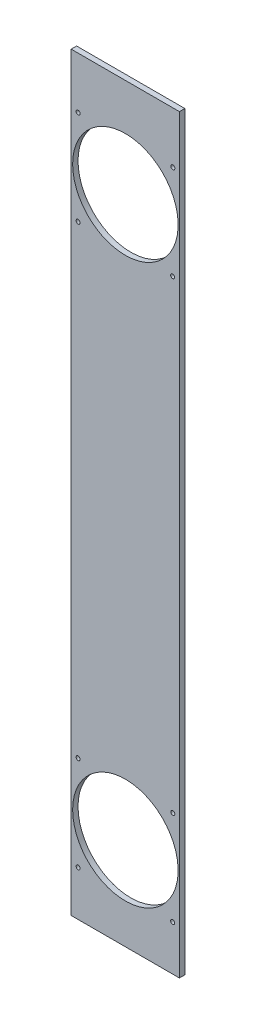
from build123d import *

# Parameters (mm, degrees)
ESQUISSE1_W                   = 120
ESQUISSE1_H                   = 832
BOSS_EXTRU_1_DEPTH            = 6
SKETCH1_R                     = 58.5
CUT_EXTRUDE1_DEPTH            = 10
LPATTERN1_COUNT               = 2
LPATTERN1_PITCH               = 620
M4_CLEARANCE_HOLE1_AT_2_COUNT = 2
M4_CLEARANCE_HOLE1_AT_2_PITCH = 104.8
M4_CLEARANCE_HOLE1_AT_3_COUNT = 2
M4_CLEARANCE_HOLE1_AT_3_PITCH = 148.351070101
M4_CLEARANCE_HOLE1_AT_4_COUNT = 2
M4_CLEARANCE_HOLE1_AT_4_PITCH = 104.8
LPATTERN2_COUNT               = 2
LPATTERN2_PITCH               = 620


with BuildPart() as part:
    # Esquisse1 → Boss.-Extru.1 (new body)
    with BuildSketch(Plane.XY):
        Rectangle(ESQUISSE1_W, ESQUISSE1_H)
    extrude(amount=BOSS_EXTRU_1_DEPTH)

    # Sketch1 → Cut-Extrude1 (cut)
    with BuildSketch(Plane(origin=(0, 0, 0), x_dir=(-1, 0, 0), z_dir=(0, 0, -1))):
        with Locations((-0.1, 306.5)):
            Circle(SKETCH1_R)
    cut_extrude1 = extrude(amount=-CUT_EXTRUDE1_DEPTH, mode=Mode.SUBTRACT)

    # LPattern1: Cut-Extrude1 ×2
    with Locations(*[(0, -i * LPATTERN1_PITCH, 0) for i in range(1, LPATTERN1_COUNT)]):
        add(cut_extrude1, mode=Mode.SUBTRACT)

    # Sketch2 → M4 Clearance Hole1 (revolve, cut)
    with BuildSketch(Plane(origin=(-52.3, 254.1, 0), x_dir=(0, 1, 0), z_dir=(1, 0, 0))):
        Polygon((0, 0), (0, 7.351936393), (2.25, 6), (2.25, 0), align=None)
    m4_clearance_hole1 = revolve(axis=Axis((-52.3, 254.1, -6.35), (0, 0, 1)), mode=Mode.SUBTRACT)

    # M4 Clearance Hole1 at 2: M4 Clearance Hole1 ×2
    with Locations(*[(0, i * M4_CLEARANCE_HOLE1_AT_2_PITCH, 0) for i in range(1, M4_CLEARANCE_HOLE1_AT_2_COUNT)]):
        add(m4_clearance_hole1, mode=Mode.SUBTRACT)

    # M4 Clearance Hole1 at 3: M4 Clearance Hole1 ×2
    with Locations(*[Vector(0.7077805365932406, 0.7064323831901992, 0) * (i * M4_CLEARANCE_HOLE1_AT_3_PITCH) for i in range(1, M4_CLEARANCE_HOLE1_AT_3_COUNT)]):
        add(m4_clearance_hole1, mode=Mode.SUBTRACT)

    # M4 Clearance Hole1 at 4: M4 Clearance Hole1 ×2
    with Locations(*[(i * M4_CLEARANCE_HOLE1_AT_4_PITCH, 0, 0) for i in range(1, M4_CLEARANCE_HOLE1_AT_4_COUNT)]):
        add(m4_clearance_hole1, mode=Mode.SUBTRACT)

    # LPattern2: M4 Clearance Hole1 ×2
    with Locations(*[(0, -i * LPATTERN2_PITCH, 0) for i in range(1, LPATTERN2_COUNT)]):
        add(m4_clearance_hole1, mode=Mode.SUBTRACT)

    # LPattern2 copy 1 sketch → LPattern2 copy 1 (revolve, cut)
    with BuildSketch(Plane(origin=(-52.3, -261.1, 0), x_dir=(0, 1, 0), z_dir=(1, 0, 0))):
        Polygon((0, 0), (0, 7.351936393), (2.25, 6), (2.25, 0), align=None)
    revolve(axis=Axis((-52.3, -261.1, -6.35), (0, 0, 1)), mode=Mode.SUBTRACT)

    # LPattern2 copy 2 sketch → LPattern2 copy 2 (revolve, cut)
    with BuildSketch(Plane(origin=(52.7, -261.1, 0), x_dir=(0, 1, 0), z_dir=(1, 0, 0))):
        Polygon((0, 0), (0, 7.351936393), (2.25, 6), (2.25, 0), align=None)
    revolve(axis=Axis((52.7, -261.1, -6.35), (0, 0, 1)), mode=Mode.SUBTRACT)

    # LPattern2 copy 3 sketch → LPattern2 copy 3 (revolve, cut)
    with BuildSketch(Plane(origin=(52.5, -365.9, 0), x_dir=(0, 1, 0), z_dir=(1, 0, 0))):
        Polygon((0, 0), (0, 7.351936393), (2.25, 6), (2.25, 0), align=None)
    revolve(axis=Axis((52.5, -365.9, -6.35), (0, 0, 1)), mode=Mode.SUBTRACT)


solid = part.part
